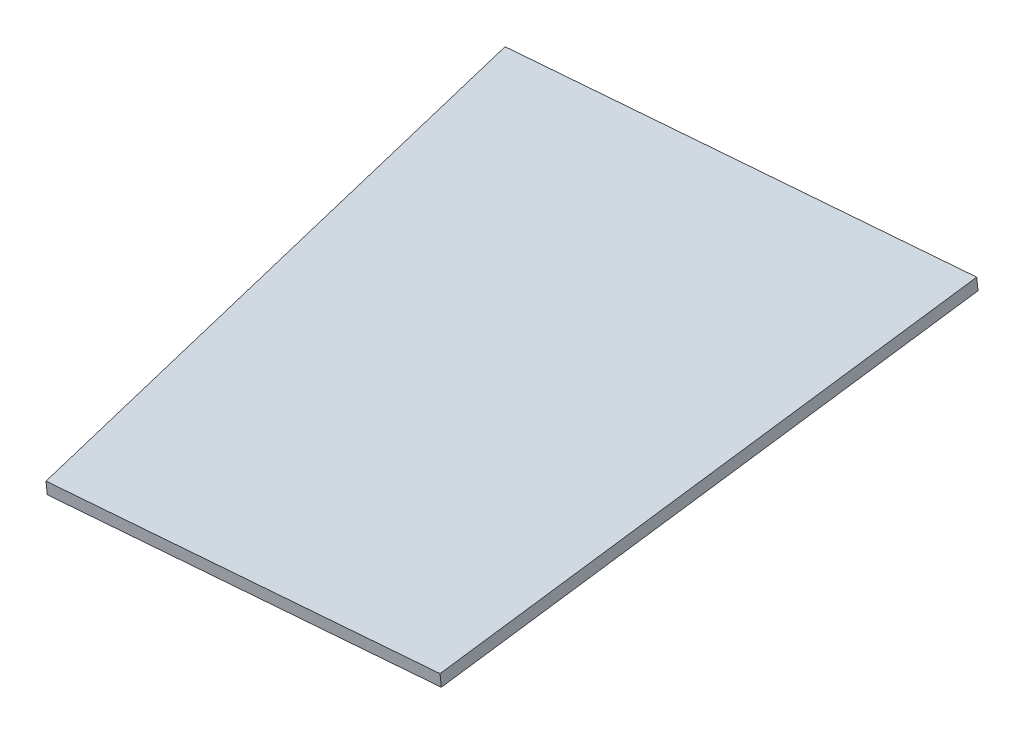
from build123d import *

# Parameters (mm, degrees)
BOSS_EXTRUDE1_DEPTH = 12.7


with BuildPart() as part:
    # PedalBox Floor → Boss-Extrude1 (new body)
    with BuildSketch(Plane(origin=(4.489071742, 322.082149379, 37.037565083), x_dir=(-0.9999035441482338, 0.013880423429573326, 0.0004860506322967613), z_dir=(-0.013845084214796764, -0.9933578117850708, -0.11423034364240246))):
        Polygon((823.697507709, -1109.279462523), (811.309313954, -1660.1683221), (1172.862113197, -1691.833937969), (1256.424166044, -1147.17864673), align=None)
    extrude(amount=BOSS_EXTRUDE1_DEPTH)


solid = part.part
